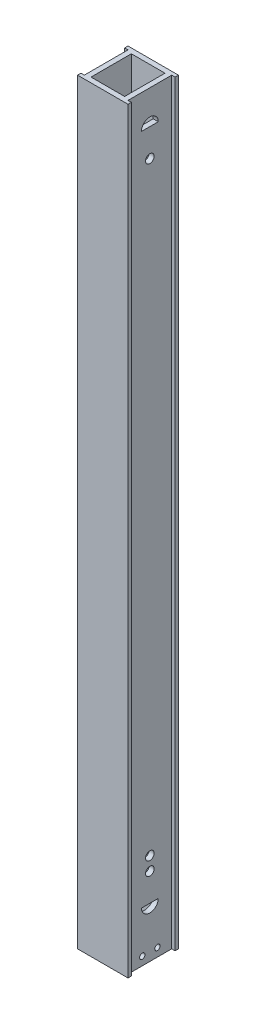
from build123d import *

# Parameters (mm, degrees)
SKETCH_1_W          = 30
SKETCH_1_H          = 450
EXTRUDE_1_DEPTH     = 30
SKETCH_2_W          = 2
SKETCH_2_H          = 26
CUT_EXTRUDE_1_DEPTH = 452.248268695
SHELL_1_T           = -3
SKETCH_3_R          = 2.55
SKETCH_3_R_2        = 1.6
CUT_EXTRUDE_2_DEPTH = 229.7116088


with BuildPart() as part:
    # 草图1 → 凸台-拉伸1 (new body)
    with BuildSketch(Plane.XY):
        Rectangle(SKETCH_1_W, SKETCH_1_H)
    extrude(amount=EXTRUDE_1_DEPTH)

    # 草图2 → 切除-拉伸1 (cut, through all)
    with BuildSketch(Plane(origin=(0, 225, 0), x_dir=(1, 0, 0), z_dir=(0, 1, 0))):
        with Locations((-14, -15)):
            Rectangle(SKETCH_2_W, SKETCH_2_H)
        with Locations((14, -15)):
            Rectangle(SKETCH_2_W, SKETCH_2_H)
    extrude(amount=-CUT_EXTRUDE_1_DEPTH, mode=Mode.SUBTRACT)

    # 抽壳1
    shell_1_openings = [part.faces().sort_by_distance(p)[0] for p in [
        (0, 225, 15),
        (0, -225, 15),
    ]]
    offset(amount=SHELL_1_T, openings=shell_1_openings)

    # 草图3 → 切除-拉伸2 (cut, through all)
    with BuildSketch(Plane(origin=(13, 0, 0), x_dir=(0, 0, -1), z_dir=(1, 0, 0))):
        with Locations((-15, 188.5)):
            Circle(SKETCH_3_R)
        with Locations((-15, -178.5)):
            Circle(SKETCH_3_R)
        with Locations((-19.5, -220)):
            Circle(SKETCH_3_R_2)
        with Locations((-15, -170.5)):
            Circle(SKETCH_3_R)
        with Locations((-10.5, -220)):
            Circle(SKETCH_3_R_2)
        with BuildLine():
            Line((-20, 205), (-10, 205))
            ThreePointArc((-10, 205), (-15, 210), (-20, 205))
        make_face()
        with BuildLine():
            Line((-20, -195), (-10, -195))
            ThreePointArc((-10, -195), (-15, -200), (-20, -195))
        make_face()
    extrude(amount=-CUT_EXTRUDE_2_DEPTH, mode=Mode.SUBTRACT)


solid = part.part
